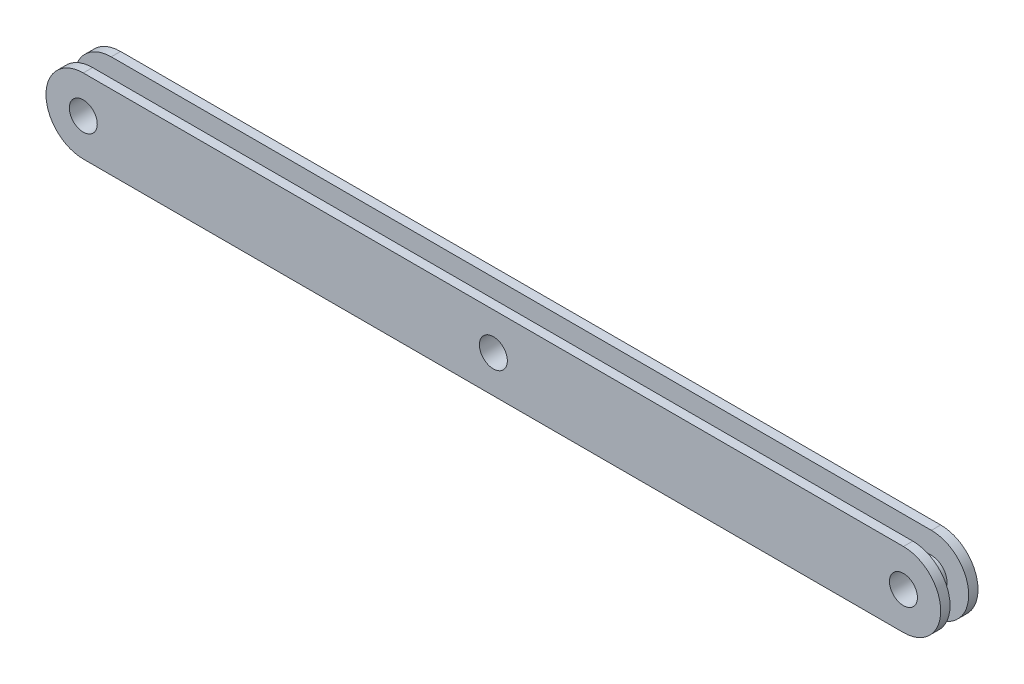
from build123d import *

# Parameters (mm, degrees)
ESQUISSE1_W             = 152.4
ESQUISSE1_H             = 12.7
BOSS_EXTRU_1_DEPTH      = 6.35
ESQUISSE2_R             = 2.38125
ENL_V_MAT_EXTRU_1_DEPTH = 154.060029074
SKETCH1_W               = 14.17076538
SKETCH1_H               = 3.175
CUT_REVOLVE1_ANGLE      = 180
SKETCH2_W               = 3.175
SKETCH2_H               = 3.683
CUT_EXTRUDE1_DEPTH      = 154.060029074


with BuildPart() as part:
    # Esquisse1 → Boss.-Extru.1 (new body)
    with BuildSketch(Plane.XY):
        with Locations((-76.2, 6.35)):
            Rectangle(ESQUISSE1_W, ESQUISSE1_H)
    extrude(amount=-BOSS_EXTRU_1_DEPTH)

    # Esquisse2 → Enlèv. mat.-Extru.1 (cut, through all)
    with BuildSketch(Plane.XY):
        with Locations((-146.05, 6.35)):
            Circle(ESQUISSE2_R)
        with Locations((-76.2, 6.35)):
            Circle(ESQUISSE2_R)
        with Locations((-6.35, 6.35)):
            Circle(ESQUISSE2_R)
        with BuildLine():
            Line((0, 12.7), (-6.35, 12.7))
            ThreePointArc((-6.35, 12.7), (-1.859871939, 10.840128061), (0, 6.35))
            Line((0, 6.35), (0, 12.7))
        make_face()
        with BuildLine():
            Line((0, 0), (0, 6.35))
            ThreePointArc((0, 6.35), (-1.859871939, 1.859871939), (-6.35, 0))
            Line((-6.35, 0), (0, 0))
        make_face()
        with BuildLine():
            ThreePointArc((-152.4, 6.35), (-150.540128061, 10.840128061), (-146.05, 12.7))
            Line((-146.05, 12.7), (-152.4, 12.7))
            Line((-152.4, 12.7), (-152.4, 6.35))
        make_face()
        with BuildLine():
            ThreePointArc((-146.05, 0), (-150.540128061, 1.859871939), (-152.4, 6.35))
            Line((-152.4, 6.35), (-152.4, 0))
            Line((-152.4, 0), (-146.05, 0))
        make_face()
    extrude(amount=-ENL_V_MAT_EXTRU_1_DEPTH, mode=Mode.SUBTRACT)

    # Sketch1 → Cut-Revolve1 (revolve, symmetric, cut)
    with BuildSketch(Plane(origin=(0, 6.35, 0), x_dir=(1, 0, 0), z_dir=(0, 1, 0))) as cut_revolve1_sk:
        Polygon((-150.5585, 1.5875), (-152.4, 1.5875), (-152.4, 4.7625), (-150.5585, 4.7625), (-148.717, 4.7625), (-148.717, 1.5875), align=None)
        with Locations((-159.48538269, 3.175)):
            Rectangle(SKETCH1_W, SKETCH1_H)
    cut_revolve1 = revolve(axis=Axis((-146.05, 6.35, -6.35), (0, 0, 1)), revolution_arc=CUT_REVOLVE1_ANGLE / 2, mode=Mode.SUBTRACT)
    cut_revolve1 = cut_revolve1 + revolve(cut_revolve1_sk.sketch, axis=Axis((-146.05, 6.35, -6.35), (0, 0, -1)), revolution_arc=CUT_REVOLVE1_ANGLE / 2, mode=Mode.SUBTRACT)

    # Mirror1: Cut-Revolve1 across plane
    add(cut_revolve1.mirror(Plane(origin=(-76.2, 0, 0), x_dir=(0, 0, 1), z_dir=(1, 0, 0))), mode=Mode.SUBTRACT)

    # Sketch2 → Cut-Extrude1 (cut, through all)
    with BuildSketch(Plane(origin=(0, 0, 0), x_dir=(0, 0, -1), z_dir=(1, 0, 0))):
        with Locations((3.175, 10.8585)):
            Rectangle(SKETCH2_W, SKETCH2_H)
    cut_extrude1 = extrude(amount=-CUT_EXTRUDE1_DEPTH, mode=Mode.SUBTRACT)

    # Mirror2: Cut-Extrude1 across plane
    add(cut_extrude1.mirror(Plane.ZX.offset(6.35)), mode=Mode.SUBTRACT)


solid = part.part
